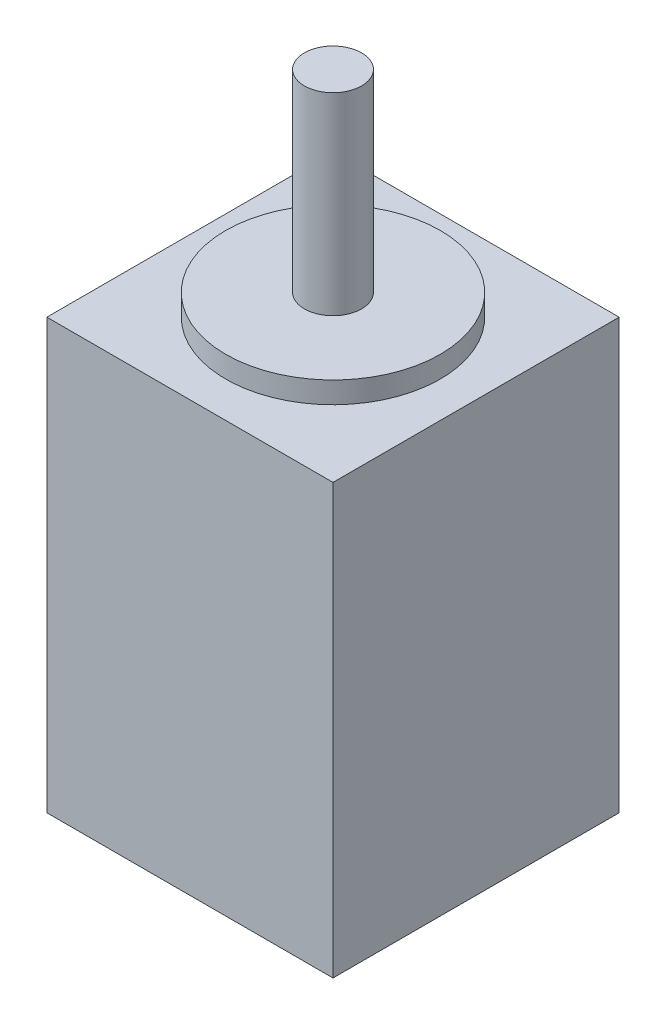
from build123d import *

# Parameters (mm, degrees)
SKETCH1_W           = 20
SKETCH1_H           = 20
BOSS_EXTRUDE1_DEPTH = 30
SKETCH2_R           = 7.5
BOSS_EXTRUDE2_DEPTH = 1.5
SKETCH3_R           = 2
BOSS_EXTRUDE4_DEPTH = 13.5


with BuildPart() as part:
    # Sketch1 → Boss-Extrude1 (new body)
    with BuildSketch(Plane(origin=(0, 0, 0), x_dir=(1, 0, 0), z_dir=(0, 1, 0))):
        with Locations((10, 10)):
            Rectangle(SKETCH1_W, SKETCH1_H)
    extrude(amount=BOSS_EXTRUDE1_DEPTH)

    # Sketch2 → Boss-Extrude2 (add)
    with BuildSketch(Plane(origin=(0, 30, 0), x_dir=(1, 0, 0), z_dir=(0, 1, 0))):
        with Locations(Location((10, 10, 0), (0, 0, 90))):
            Circle(SKETCH2_R)
    extrude(amount=BOSS_EXTRUDE2_DEPTH)

    # Sketch3 → Boss-Extrude4 (add)
    with BuildSketch(Plane(origin=(0, 31.5, 0), x_dir=(1, 0, 0), z_dir=(0, 1, 0))):
        with Locations(Location((10, 10, 0), (0, 0, 270))):
            Circle(SKETCH3_R)
    extrude(amount=BOSS_EXTRUDE4_DEPTH)


solid = part.part
